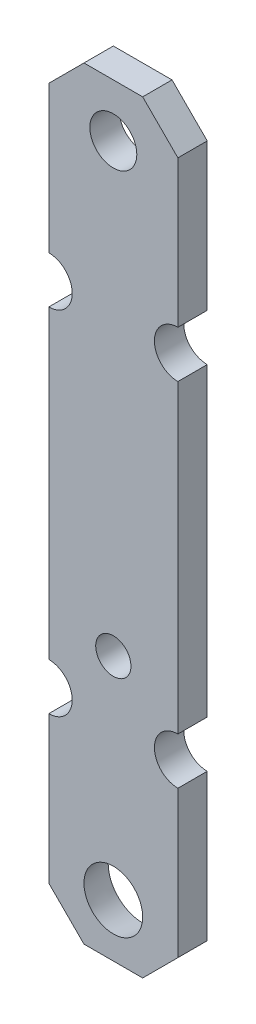
from build123d import *

# Parameters (mm, degrees)
ESQUISSE1_R      = 4
ESQUISSE1_R_2    = 3
EXTRUSION1_DEPTH = 5


with BuildPart() as part:
    # Esquisse1 → Extrusion1 (new body)
    with BuildSketch(Plane.XY):
        with BuildLine():
            Line((-5, 65), (5, 65))
            Line((5, 65), (11, 59))
            Line((11, 59), (11, 34))
            ThreePointArc((11, 34), (7, 30), (11, 26))
            Line((11, 26), (11, -26))
            ThreePointArc((11, -26), (7, -30), (11, -34))
            Line((11, -34), (11, -59))
            Line((11, -59), (5, -65))
            Line((5, -65), (-5, -65))
            Line((-5, -65), (-11, -59))
            Line((-11, -59), (-11, -34))
            ThreePointArc((-11, -34), (-7, -30), (-11, -26))
            Line((-11, -26), (-11, 26))
            ThreePointArc((-11, 26), (-7, 30), (-11, 34))
            Line((-11, 34), (-11, 59))
            Line((-11, 59), (-5, 65))
        make_face()
        with Locations((0, 56)):
            Circle(ESQUISSE1_R, mode=Mode.SUBTRACT)
        with Locations((0, -20)):
            Circle(ESQUISSE1_R_2, mode=Mode.SUBTRACT)
    extrude(amount=EXTRUSION1_DEPTH)

    # Esquisse2 → Enlèvement de matière-Révolution1 (revolve, cut)
    with BuildSketch(Plane(origin=(0, 0, 0), x_dir=(0, 0, -1), z_dir=(1, 0, 0)), mode=Mode.PRIVATE) as enl_vement_de_mati_re_r_volution1_sk:
        Polygon((-5, -51), (0, -50.118365096), (0, -52.065498843), (0, -56), (-5, -56), align=None)
    revolve(enl_vement_de_mati_re_r_volution1_sk.sketch.rotate(Axis((0, -56, -5.75818426), (0, 0, 1)), 90), axis=Axis((0, -56, -5.75818426), (0, 0, 1)), mode=Mode.SUBTRACT)


solid = part.part
